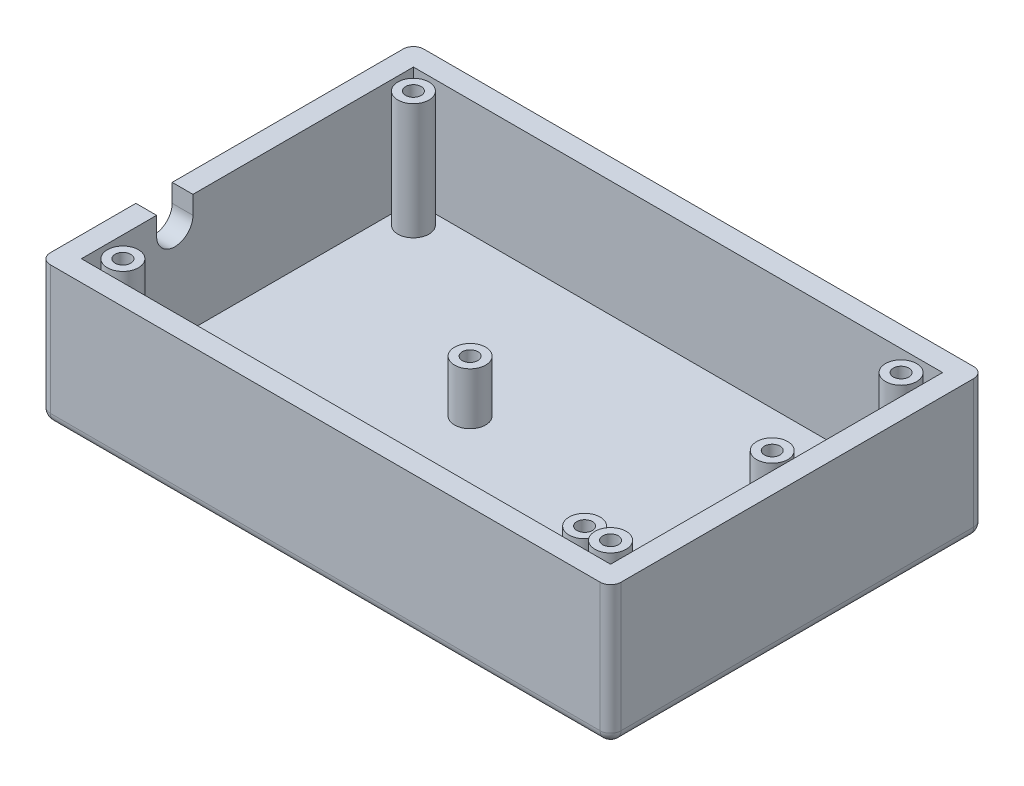
from build123d import *

# Parameters (mm, degrees)
SKETCH2_W            = 69.85
SKETCH2_H            = 45.72
BOSS_EXTRUDE1_DEPTH  = 17.018
SKETCH3_W            = 64.77
SKETCH3_H            = 40.64
CUT_EXTRUDE1_DEPTH   = 14.224
SKETCH13_R           = 1.905
BOSS_EXTRUDE5_DEPTH  = 6.35
SKETCH14_R           = 0.9525
CUT_EXTRUDE4_DEPTH   = 6.35
CUT_EXTRUDE5_DEPTH   = 2.54
FILLET1_R            = 1.27
SKETCH18_R           = 1.905
BOSS_EXTRUDE11_DEPTH = 14.224
SKETCH19_R           = 0.9525
CUT_EXTRUDE6_DEPTH   = 6.35


with BuildPart() as part:
    # Sketch2 → Boss-Extrude1 (new body)
    with BuildSketch(Plane(origin=(0, 0, 0), x_dir=(1, 0, 0), z_dir=(0, 1, 0))):
        with Locations((34.925, 22.86)):
            Rectangle(SKETCH2_W, SKETCH2_H)
    extrude(amount=BOSS_EXTRUDE1_DEPTH)

    # Sketch3 → Cut-Extrude1 (cut)
    with BuildSketch(Plane(origin=(0, 17.018, 0), x_dir=(1, 0, 0), z_dir=(0, 1, 0))):
        with Locations((34.925, 22.86)):
            Rectangle(SKETCH3_W, SKETCH3_H)
    extrude(amount=-CUT_EXTRUDE1_DEPTH, mode=Mode.SUBTRACT)

    # Sketch13 → Boss-Extrude5 (add)
    with BuildSketch(Plane(origin=(0, 2.794, 0), x_dir=(1, 0, 0), z_dir=(0, 1, 0))):
        with Locations(Location((57.277, 32.3596, 0), (0, 0, 270))):
            Circle(SKETCH13_R)
        with Locations(Location((53.7972, 12.8778, 0), (0, 0, 270))):
            Circle(SKETCH13_R)
        with Locations(Location((28.7782, 23.876, 0), (0, 0, 270))):
            Circle(SKETCH13_R)
    extrude(amount=BOSS_EXTRUDE5_DEPTH)

    # Sketch14 → Cut-Extrude4 (cut)
    with BuildSketch(Plane(origin=(0, 9.144, 0), x_dir=(1, 0, 0), z_dir=(0, 1, 0))):
        with Locations(Location((57.277, 32.3596, 0), (0, 0, 270))):
            Circle(SKETCH14_R)
        with Locations(Location((53.7972, 12.8778, 0), (0, 0, 270))):
            Circle(SKETCH14_R)
        with Locations(Location((28.7782, 23.876, 0), (0, 0, 270))):
            Circle(SKETCH14_R)
    extrude(amount=-CUT_EXTRUDE4_DEPTH, mode=Mode.SUBTRACT)

    # Sketch17 → Cut-Extrude5 (cut)
    with BuildSketch(Plane.ZY):
        with BuildLine():
            Line((-16.1925, 14.7955), (-16.1925, 17.018))
            Line((-16.1925, 17.018), (-11.7475, 17.018))
            Line((-11.7475, 17.018), (-11.7475, 14.7955))
            ThreePointArc((-11.7475, 14.7955), (-13.97, 12.573), (-16.1925, 14.7955))
        make_face()
    extrude(amount=-CUT_EXTRUDE5_DEPTH, mode=Mode.SUBTRACT)

    # Fillet1
    fillet1_edges = [part.edges().sort_by_distance(p)[0] for p in [
        (34.925, 0, -45.72),
        (69.85, 0, -22.86),
        (34.925, 0, 0),
        (0, 0, -22.86),
        (0, 8.509, -45.72),
        (69.85, 8.509, -45.72),
        (69.85, 8.509, 0),
        (0, 8.509, 0),
    ]]
    fillet(fillet1_edges, radius=FILLET1_R)

    # Sketch18 → Boss-Extrude11 (add)
    with BuildSketch(Plane(origin=(0, 2.794, 0), x_dir=(1, 0, 0), z_dir=(0, 1, 0))):
        with Locations(Location((5.08, 40.64, 0), (0, 0, 90))):
            Circle(SKETCH18_R)
        with Locations(Location((64.77, 40.64, 0), (0, 0, 90))):
            Circle(SKETCH18_R)
        with Locations(Location((5.08, 5.08, 0), (0, 0, 90))):
            Circle(SKETCH18_R)
        with Locations(Location((64.77, 5.08, 0), (0, 0, 90))):
            Circle(SKETCH18_R)
    extrude(amount=BOSS_EXTRUDE11_DEPTH)

    # Sketch19 → Cut-Extrude6 (cut)
    with BuildSketch(Plane(origin=(0, 17.018, 0), x_dir=(1, 0, 0), z_dir=(0, 1, 0))):
        with Locations(Location((5.08, 40.64, 0), (0, 0, 270))):
            Circle(SKETCH19_R)
        with Locations(Location((64.77, 40.64, 0), (0, 0, 270))):
            Circle(SKETCH19_R)
        with Locations(Location((64.77, 5.08, 0), (0, 0, 270))):
            Circle(SKETCH19_R)
        with Locations(Location((5.08, 5.08, 0), (0, 0, 270))):
            Circle(SKETCH19_R)
    extrude(amount=-CUT_EXTRUDE6_DEPTH, mode=Mode.SUBTRACT)


solid = part.part
